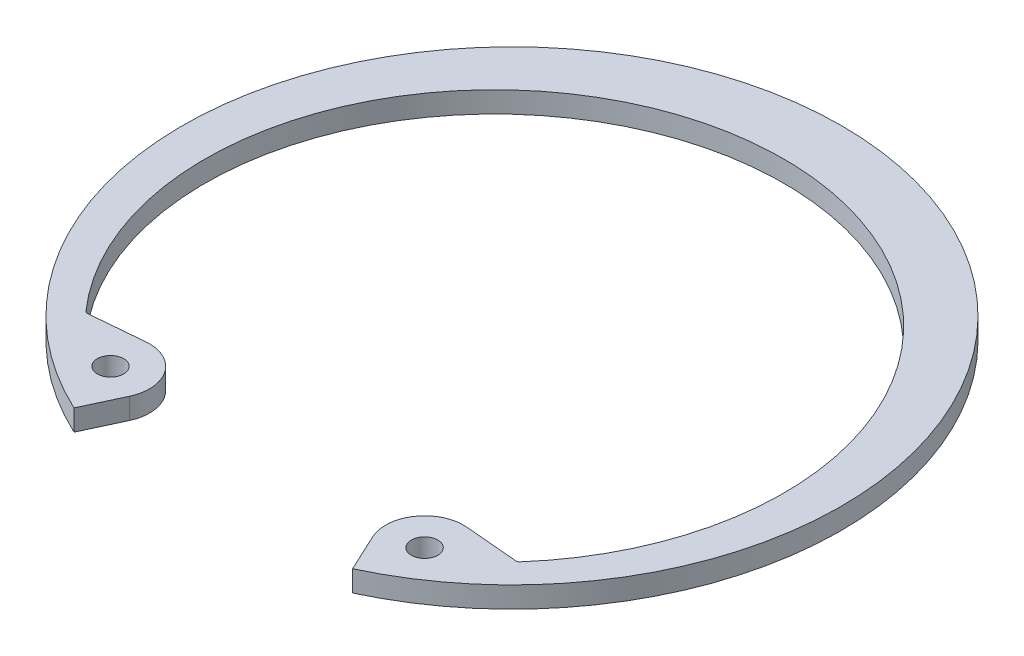
from build123d import *

# Parameters (mm, degrees)
SKETCH2_R      = 0.9906
EXTRUDE1_DEPTH = 1.5748
FILLET1_R      = 0.254


with BuildPart() as part:
    # Sketch2 → Extrude1 (new body)
    with BuildSketch(Plane(origin=(0, 0, 0), x_dir=(1, 0, 0), z_dir=(0, 1, 0))):
        with BuildLine():
            Line((10.423203237, -22.352631475), (9.105434927, -19.526668214))
            ThreePointArc((9.105434927, -19.526668214), (9.360016851, -16.616783501), (12.007341897, -15.382315559))
            Line((12.007341897, -15.382315559), (16.150495139, -15.744794499))
            ThreePointArc((16.150495139, -15.744794499), (0, 20.3454), (-16.150495139, -15.744794499))
            Line((-16.150495139, -15.744794499), (-12.007341897, -15.382315559))
            ThreePointArc((-12.007341897, -15.382315559), (-9.360016851, -16.616783501), (-9.105434927, -19.526668214))
            Line((-9.105434927, -19.526668214), (-10.423203237, -22.352631475))
            ThreePointArc((-10.423203237, -22.352631475), (0, 24.6634), (10.423203237, -22.352631475))
        make_face()
        with Locations(Location((11.752759973, -18.292200272, 0), (0, 0, 270))):
            Circle(SKETCH2_R, mode=Mode.SUBTRACT)
        with Locations(Location((-11.752759973, -18.292200272, 0), (0, 0, 270))):
            Circle(SKETCH2_R, mode=Mode.SUBTRACT)
    extrude(amount=-EXTRUDE1_DEPTH)

    # Fillet1
    fillet1_edges = [part.edges().sort_by_distance(p)[0] for p in [
        (16.150495139, -0.7874, 15.744794499),
        (-16.150495139, -0.7874, 15.744794499),
    ]]
    fillet(fillet1_edges, radius=FILLET1_R)


solid = part.part
